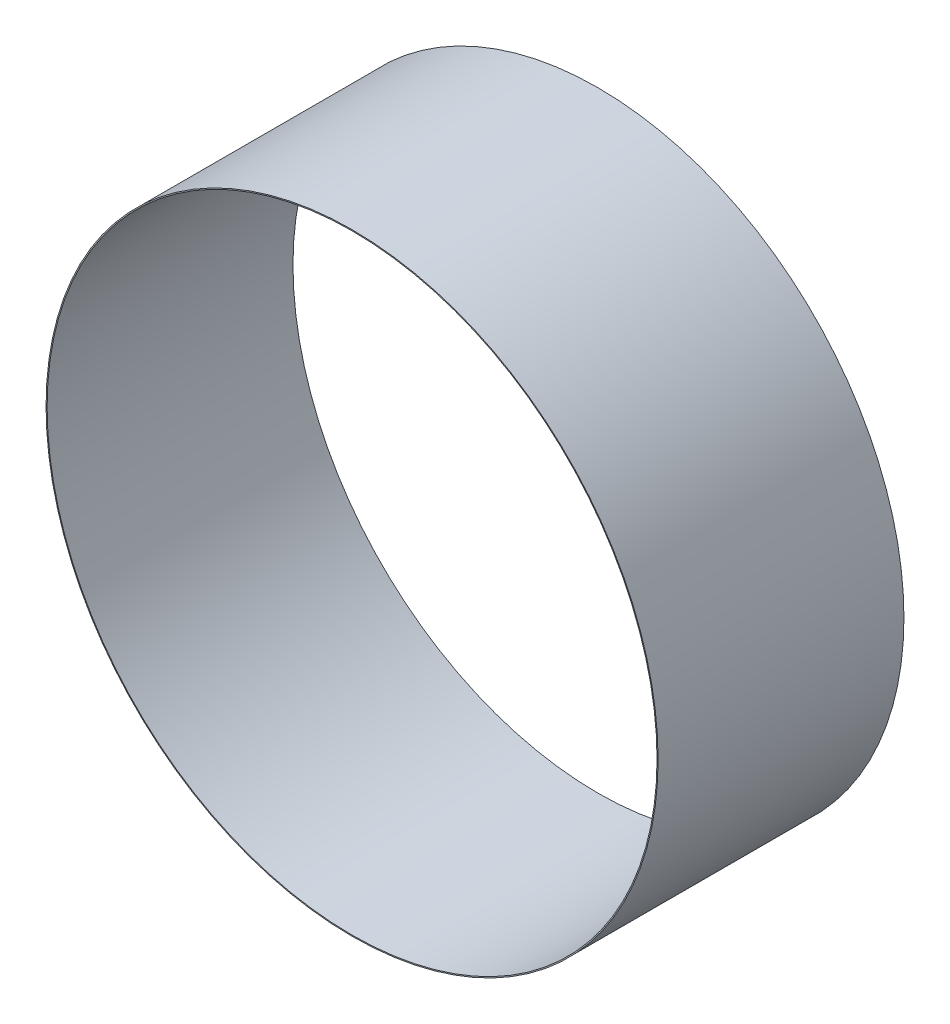
from build123d import *

# Parameters (mm, degrees)
SKIZZE1_R                       = 60.990787353
SKIZZE1_R_2                     = 60.780006603
AUFSATZ_LINEAR_AUSTRAGEN1_DEPTH = 49


with BuildPart() as part:
    # Skizze1 → Aufsatz-Linear austragen1 (new body)
    with BuildSketch(Plane.XY):
        Circle(SKIZZE1_R)
        Circle(SKIZZE1_R_2, mode=Mode.SUBTRACT)
    extrude(amount=AUFSATZ_LINEAR_AUSTRAGEN1_DEPTH)


solid = part.part
